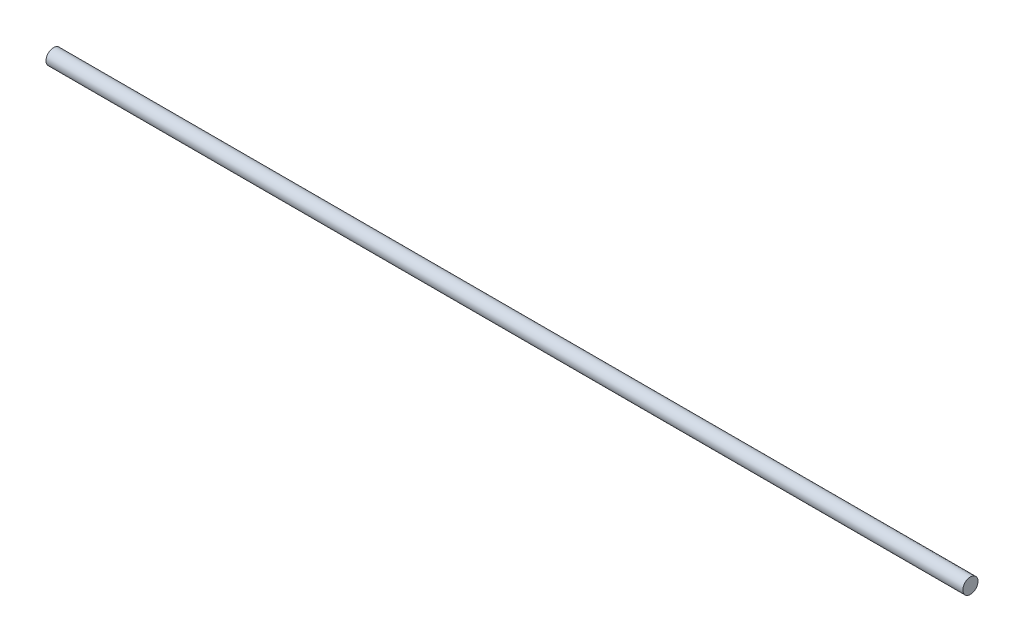
from build123d import *

# Parameters (mm, degrees)
CROQUIS1_R              = 4
SALIENTE_EXTRUIR1_DEPTH = 241.185


with BuildPart() as part:
    # Croquis1 → Saliente-Extruir1 (new, symmetric)
    with BuildSketch(Plane(origin=(0, 0, 0), x_dir=(0, 0, -1), z_dir=(1, 0, 0))):
        Circle(CROQUIS1_R)
    extrude(amount=SALIENTE_EXTRUIR1_DEPTH, both=True)


solid = part.part
